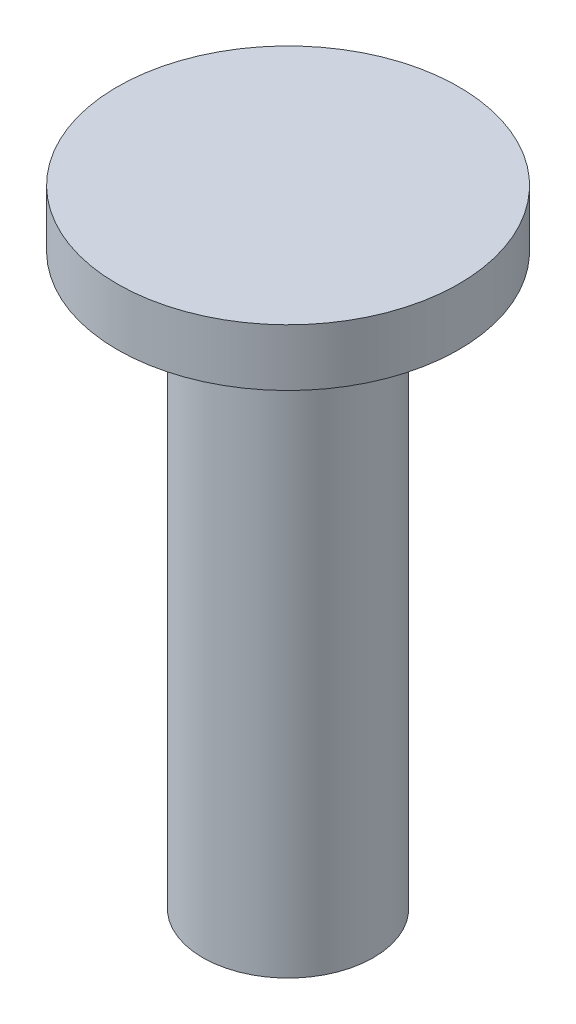
from build123d import *

# Parameters (mm, degrees)
SKETCH1_R           = 9.525
BOSS_EXTRUDE1_DEPTH = 63.5
SKETCH2_R           = 19.05
BOSS_EXTRUDE2_DEPTH = 6.35


with BuildPart() as part:
    # Sketch1 → Boss-Extrude1 (new body)
    with BuildSketch(Plane(origin=(0, 0, 0), x_dir=(1, 0, 0), z_dir=(0, 1, 0))):
        with Locations(Location((0, 0, 0), (0, 0, 270))):
            Circle(SKETCH1_R)
    extrude(amount=BOSS_EXTRUDE1_DEPTH)

    # Sketch2 → Boss-Extrude2 (add)
    with BuildSketch(Plane(origin=(0, 63.5, 0), x_dir=(1, 0, 0), z_dir=(0, 1, 0))):
        with Locations(Location((0, 0, 0), (0, 0, 270))):
            Circle(SKETCH2_R)
    extrude(amount=BOSS_EXTRUDE2_DEPTH)


solid = part.part
